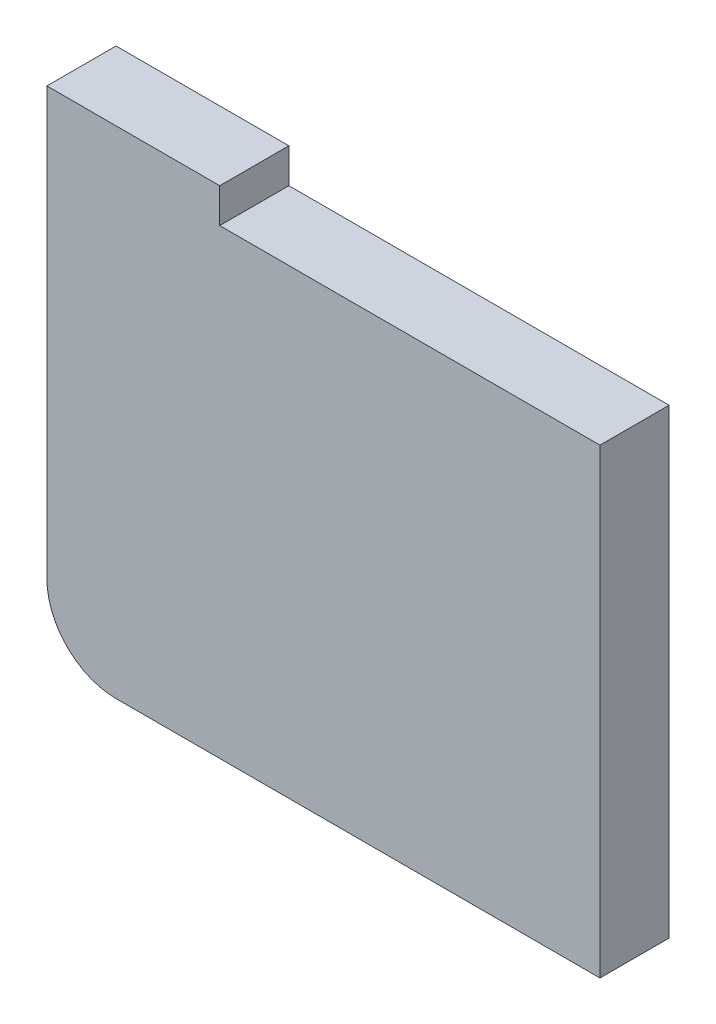
from build123d import *

# Parameters (mm, degrees)
BOSS_EXTRUDE1_DEPTH = 2


with BuildPart() as part:
    # Sketch1 → Boss-Extrude1 (new body)
    with BuildSketch(Plane.XY):
        with BuildLine():
            Line((-37.821244, 0.214456948), (-37.821244, 0))
            Line((-37.821244, 0), (-37.821244, -6))
            ThreePointArc((-37.821244, -6), (-37.235457562, -7.414213562), (-35.821244, -8))
            Line((-35.821244, -8), (-21.821244, -8))
            Line((-21.821244, -8), (-21.821244, 5.35))
            Line((-21.821244, 5.35), (-32.821244, 5.35))
            Line((-32.821244, 5.35), (-32.821244, 6.35))
            Line((-32.821244, 6.35), (-37.821244, 6.35))
            Line((-37.821244, 6.35), (-37.821244, 4))
            Line((-37.821244, 4), (-37.821244, 1))
            Line((-37.821244, 1), (-37.821244, 0.587709258))
            Line((-37.821244, 0.587709258), (-37.821244, 0.214456948))
        make_face()
    extrude(amount=BOSS_EXTRUDE1_DEPTH)


solid = part.part
